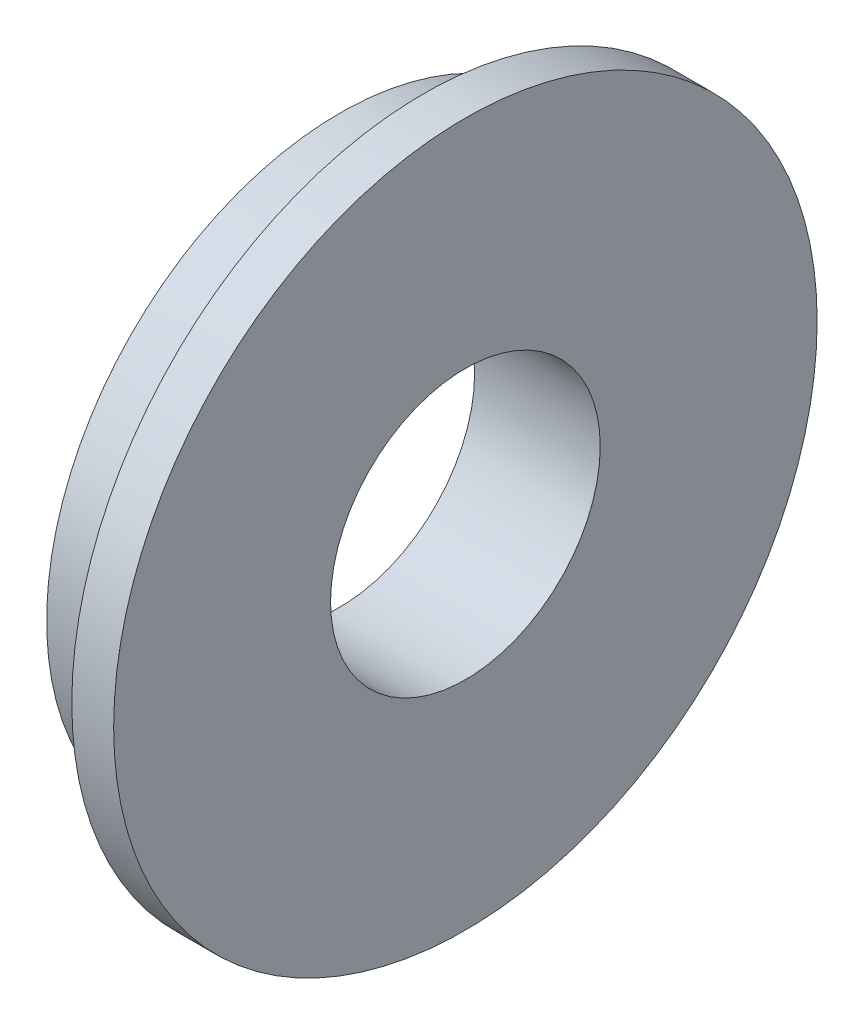
from build123d import *

# Parameters (mm, degrees)
SKETCH1_R           = 4.445
SKETCH1_R_2         = 2.0447
BOSS_EXTRUDE1_DEPTH = 1.27
SKETCH2_R           = 5.334
SKETCH2_R_2         = 2.0447
BOSS_EXTRUDE2_DEPTH = 0.635


with BuildPart() as part:
    # Sketch1 → Boss-Extrude1 (new body)
    with BuildSketch(Plane(origin=(0, 0, 0), x_dir=(0, 0, -1), z_dir=(1, 0, 0))):
        Circle(SKETCH1_R)
        Circle(SKETCH1_R_2, mode=Mode.SUBTRACT)
    extrude(amount=BOSS_EXTRUDE1_DEPTH)

    # Sketch2 → Boss-Extrude2 (add)
    with BuildSketch(Plane.ZY.offset(-1.27)):
        Circle(SKETCH2_R)
        Circle(SKETCH2_R_2, mode=Mode.SUBTRACT)
    extrude(amount=-BOSS_EXTRUDE2_DEPTH)


solid = part.part
